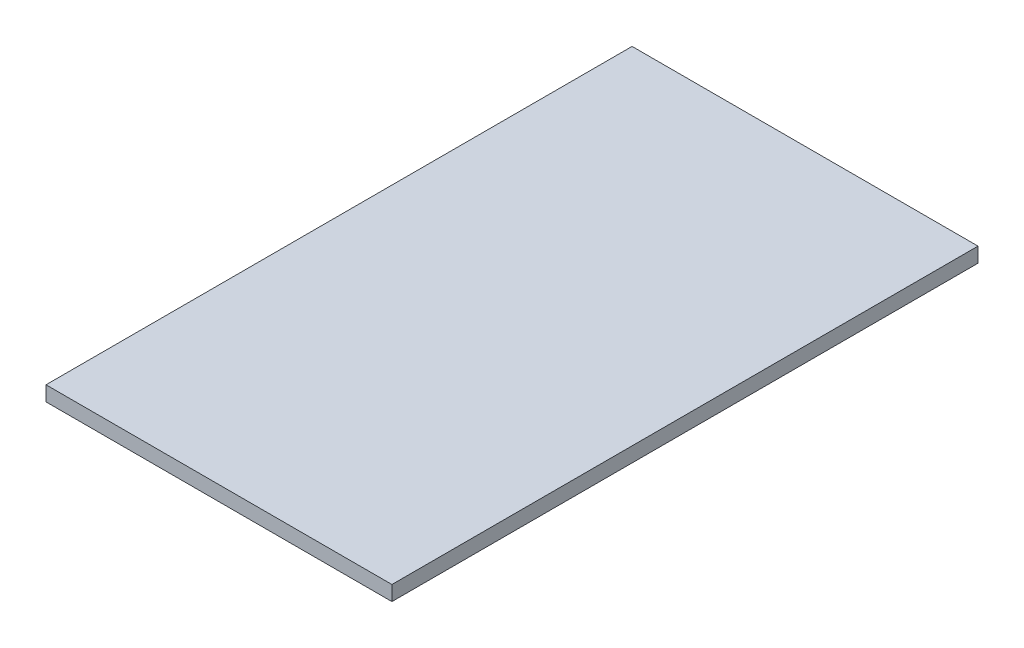
from build123d import *

# Parameters (mm, degrees)
SKETCH_1_W          = 70
SKETCH_1_H          = 387.2
EXTRUDE_1_DEPTH     = 3
SKETCH_2_W          = 70
SKETCH_2_H          = 268.60000206
CUT_EXTRUDE_1_DEPTH = 10


with BuildPart() as part:
    # 草图1 → 凸台-拉伸1 (new body)
    with BuildSketch(Plane(origin=(0, 0, 0), x_dir=(1, 0, 0), z_dir=(0, 1, 0))):
        with Locations((15, 0)):
            Rectangle(SKETCH_1_W, SKETCH_1_H)
    extrude(amount=EXTRUDE_1_DEPTH)

    # 草图2 → 切除-拉伸1 (cut)
    with BuildSketch(Plane(origin=(0, 3, 0), x_dir=(1, 0, 0), z_dir=(0, 1, 0))):
        with Locations((15, 59.29999897)):
            Rectangle(SKETCH_2_W, SKETCH_2_H)
    extrude(amount=-CUT_EXTRUDE_1_DEPTH, mode=Mode.SUBTRACT)


solid = part.part
